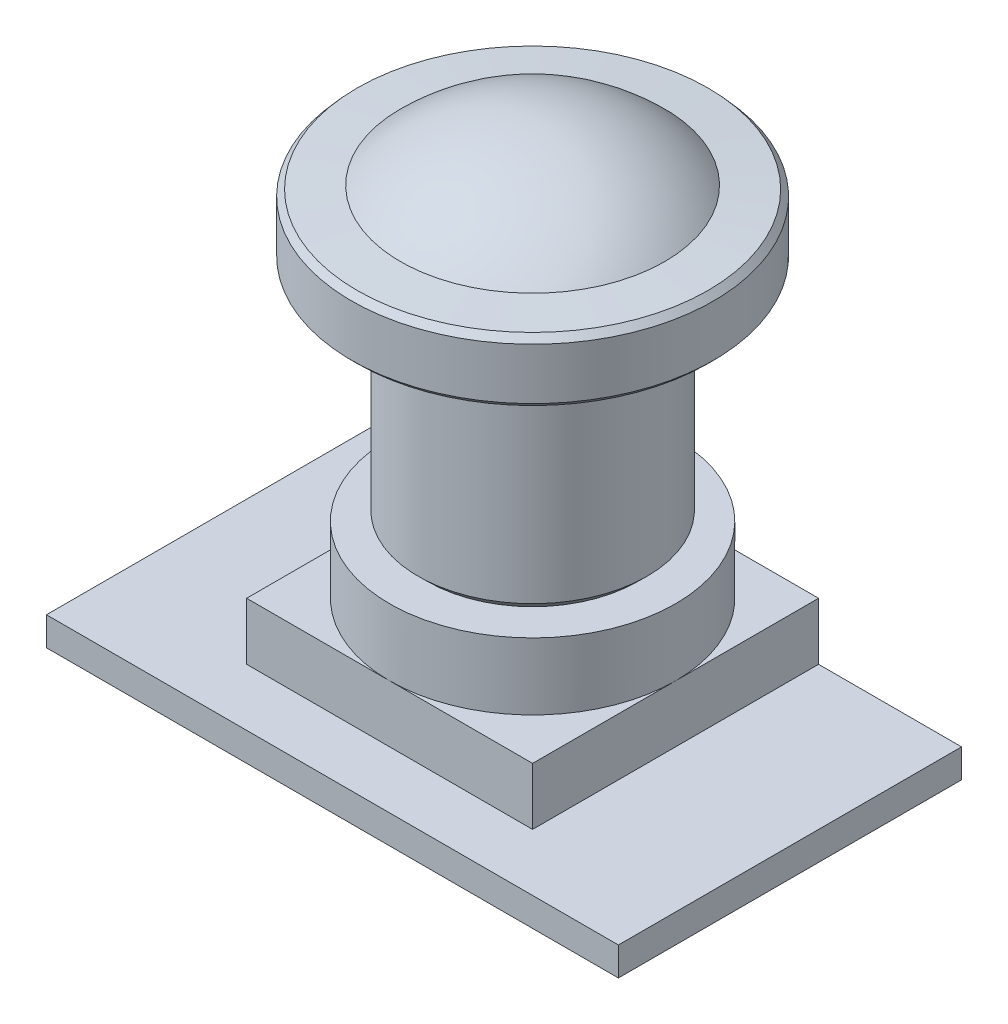
from build123d import *

# Parameters (mm, degrees)
SCALE1_SCALE        = 0.268090154
SKETCH2_R           = 7.5
BOSS_EXTRUDE1_DEPTH = 3.5
SKETCH3_W           = 15
SKETCH3_H           = 15
BOSS_EXTRUDE2_DEPTH = 3
SKETCH4_W           = 30
SKETCH4_H           = 18
BOSS_EXTRUDE3_DEPTH = 1.5


with BuildPart() as part:
    # Model → Revolve1 (revolve)
    with BuildSketch(Plane.XY):
        with BuildLine():
            Line((35.565588, 69.903749404), (35.565588, 2.41570256))
            Line((35.565588, 2.41570256), (15.0702518, 2.41570256))
            Line((15.0702518, 2.41570256), (13.1823206, 4.2595038))
            Line((13.1823206, 4.2595038), (13.1823206, 43.648122))
            Line((13.1823206, 43.648122), (14.1483334, 44.569888))
            Line((14.1483334, 44.569888), (15.0702518, 44.569888))
            Line((15.0702518, 44.569888), (15.0702518, 46.238668))
            Line((15.0702518, 46.238668), (2.9572712, 46.238668))
            Line((2.9572712, 46.238668), (1.28984502, 46.238668))
            Line((1.28984502, 46.238668), (0.148828252, 47.38116))
            Line((0.148828252, 47.38116), (0.148828252, 57.436766))
            Line((0.148828252, 57.436766), (1.24574554, 58.665872))
            Line((1.24574554, 58.665872), (9.701542865, 59.330571423))
            ThreePointArc((9.701542865, 59.330571423), (21.589655561, 67.170766536), (35.565588, 69.903749404))
        make_face()
    revolve(axis=Axis((35.565588, 69.903749404, 0), (0, -1, 0)))


with BuildPart() as part_1:
    # Scale1: scaled about (35.565588, 38.752959179, 0)
    add(part.part.scale(SCALE1_SCALE).moved(Location((26.030804028, 28.363672377, 0))))

    # Sketch2 → Boss-Extrude1 (add)
    with BuildSketch(Plane.XZ.offset(-29.011298449)):
        with Locations((35.565588, 0)):
            Circle(SKETCH2_R)
    extrude(amount=BOSS_EXTRUDE1_DEPTH)

    # Sketch3 → Boss-Extrude2 (add)
    with BuildSketch(Plane.XZ.offset(-25.511298449)):
        with Locations((35.565588, 0)):
            Rectangle(SKETCH3_W, SKETCH3_H)
    extrude(amount=BOSS_EXTRUDE2_DEPTH)

    # Sketch4 → Boss-Extrude3 (add)
    with BuildSketch(Plane.XZ.offset(-22.511298449)):
        with Locations((35.565588, 1.5)):
            Rectangle(SKETCH4_W, SKETCH4_H)
    extrude(amount=BOSS_EXTRUDE3_DEPTH)


solid = part_1.part
